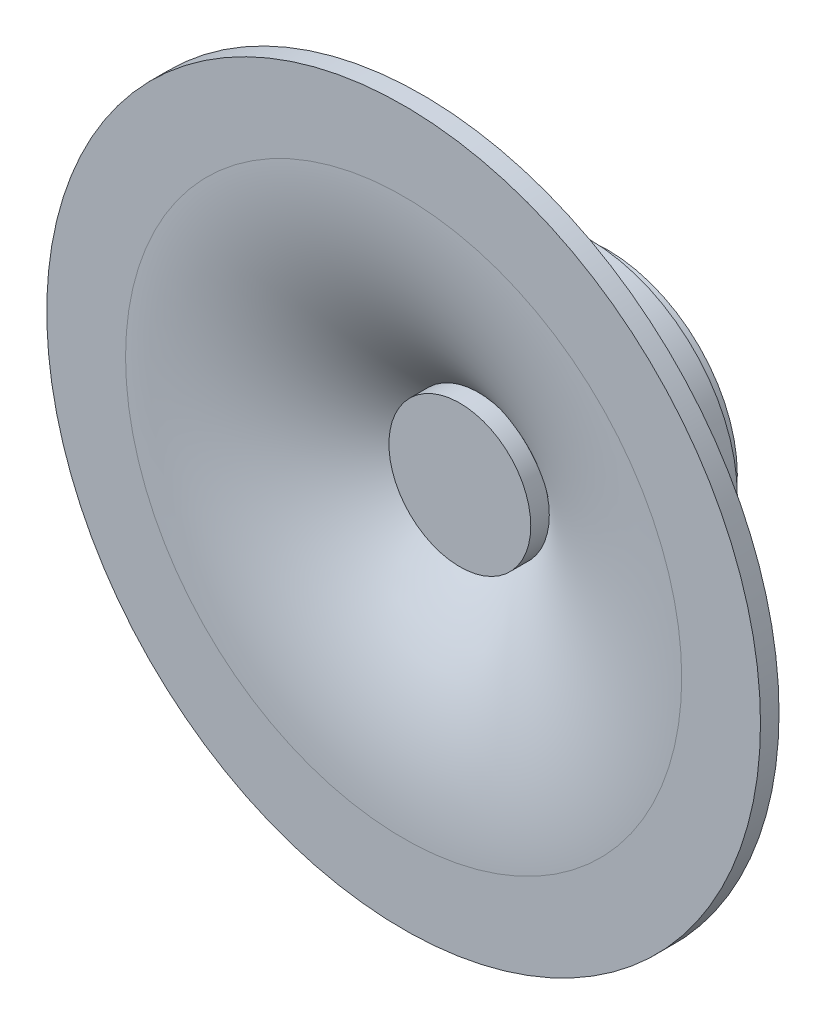
from build123d import *


with BuildPart() as part:
    # Sketch1 → Revolve1 (revolve)
    with BuildSketch(Plane(origin=(0, 0, 0), x_dir=(0, 0, -1), z_dir=(1, 0, 0)), mode=Mode.PRIVATE) as revolve1_sk:
        with BuildLine():
            Line((20, 0), (20, 14))
            Line((20, 14), (18, 14))
            Line((18, 14), (18, 16))
            Line((18, 16), (12, 16))
            Line((12, 16), (12, 14))
            Line((12, 14), (10, 14))
            ThreePointArc((10, 14), (9.324264635, 16.371708245), (7.5, 18.031128874))
            Line((7.5, 18.031128874), (0, 35))
            Line((0, 35), (0, 38.5))
            Line((0, 38.5), (-2, 38.5))
            Line((-2, 38.5), (-2, 30))
            ThreePointArc((-2, 30), (0.078015449, 18.119640862), (6.065310471, 7.65))
            Line((6.065310471, 7.65), (4.065310471, 7.65))
            Line((4.065310471, 7.65), (4.065310471, 0))
            Line((4.065310471, 0), (20, 0))
        make_face()
    revolve(revolve1_sk.sketch.rotate(Axis((0, 0, -4.065310471), (0, 0, -1)), 90), axis=Axis((0, 0, -4.065310471), (0, 0, -1)))


solid = part.part
